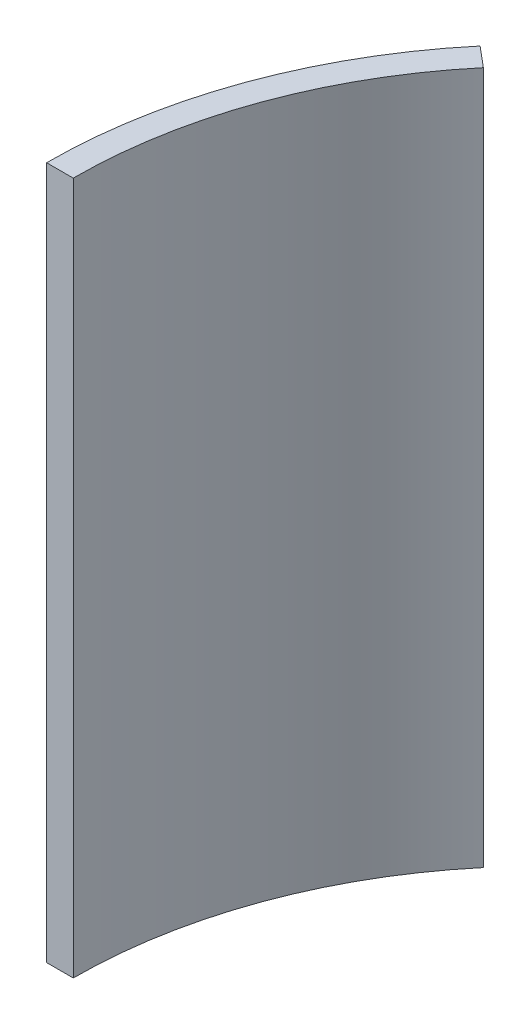
from build123d import *

# Parameters (mm, degrees)
SKETCH1_R           = 2.6
BOSS_EXTRUDE1_DEPTH = 20
BOSS_EXTRUDE2_DEPTH = 130
CUT_EXTRUDE1_DEPTH  = 146.347279326


with BuildPart() as part:
    # Sketch1 → Boss-Extrude1 (new body)
    with BuildSketch(Plane(origin=(0, 0, 0), x_dir=(1, 0, 0), z_dir=(0, 1, 0))):
        with BuildLine():
            Line((10, 0), (-10, 0))
            ThreePointArc((-10, 0), (-4.705844869, 30.024645745), (10.538067282, 56.427876097))
            Line((10.538067282, 56.427876097), (25.858956145, 43.572123903))
            ThreePointArc((25.858956145, 43.572123903), (14.088007547, 23.184242879), (10, 0))
        make_face()
        with Locations(Location((0.645465629, 10, 0), (0, 0, 270))):
            Circle(SKETCH1_R, mode=Mode.SUBTRACT)
        with Locations(Location((4.691081339, 26.604444312, 0), (0, 0, 270))):
            Circle(SKETCH1_R, mode=Mode.SUBTRACT)
        with Locations(Location((12.265090975, 41.92465826, 0), (0, 0, 270))):
            Circle(SKETCH1_R, mode=Mode.SUBTRACT)
    extrude(amount=BOSS_EXTRUDE1_DEPTH)

    # Sketch3 → Cut-Extrude1 (cut, through all)
    with BuildSketch(Plane(origin=(0, 20, 0), x_dir=(1, 0, 0), z_dir=(0, 1, 0))):
        with BuildLine():
            Line((25.858956145, 43.572123903), (10.538067282, 56.427876097))
            ThreePointArc((10.538067282, 56.427876097), (-4.705844869, 30.024645745), (-10, 0))
            Line((-10, 0), (10, 0))
            ThreePointArc((10, 0), (14.088007547, 23.184242879), (25.858956145, 43.572123903))
        make_face()
    extrude(amount=-CUT_EXTRUDE1_DEPTH, mode=Mode.SUBTRACT)


with BuildPart() as body_2:
    # Sketch2 → Boss-Extrude2 (new body)
    with BuildSketch(Plane(origin=(0, 20, 0), x_dir=(1, 0, 0), z_dir=(0, 1, 0))):
        with BuildLine():
            Line((6.707845067, 59.641814145), (10.538067282, 56.427876097))
            ThreePointArc((10.538067282, 56.427876097), (-4.705844869, 30.024645745), (-10, 0))
            Line((-10, 0), (-15, 0))
            ThreePointArc((-15, 0), (-9.404307973, 31.734746462), (6.707845067, 59.641814145))
        make_face()
    extrude(amount=BOSS_EXTRUDE2_DEPTH)


solid = body_2.part
